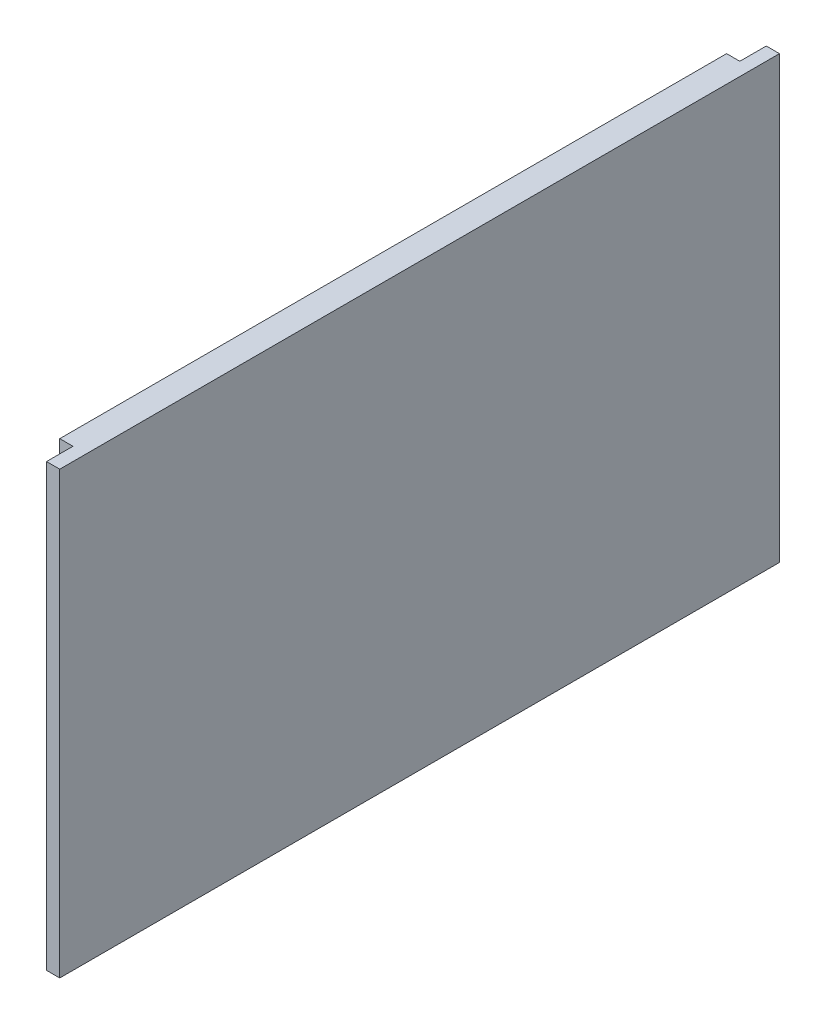
from build123d import *

# Parameters (mm, degrees)
SKETCH1_W           = 490
SKETCH1_H           = 300
BOSS_EXTRUDE1_DEPTH = 18
SKETCH5_W           = 9
SKETCH5_H           = 300
CUT_EXTRUDE1_DEPTH  = 18
SKETCH6_W           = 18
SKETCH6_H           = 300
CUT_EXTRUDE3_DEPTH  = 9


with BuildPart() as part:
    # Sketch1 → Boss-Extrude1 (new body)
    with BuildSketch(Plane(origin=(0, 0, 0), x_dir=(0, 0, -1), z_dir=(1, 0, 0))):
        with Locations((245, 150)):
            Rectangle(SKETCH1_W, SKETCH1_H)
    extrude(amount=BOSS_EXTRUDE1_DEPTH)

    # Sketch5 → Cut-Extrude1 (cut)
    with BuildSketch(Plane.XY):
        with Locations((4.5, 150)):
            Rectangle(SKETCH5_W, SKETCH5_H)
    extrude(amount=-CUT_EXTRUDE1_DEPTH, mode=Mode.SUBTRACT)

    # Sketch6 → Cut-Extrude3 (cut)
    with BuildSketch(Plane.ZY):
        with Locations((-481, 150)):
            Rectangle(SKETCH6_W, SKETCH6_H)
    extrude(amount=-CUT_EXTRUDE3_DEPTH, mode=Mode.SUBTRACT)


solid = part.part
